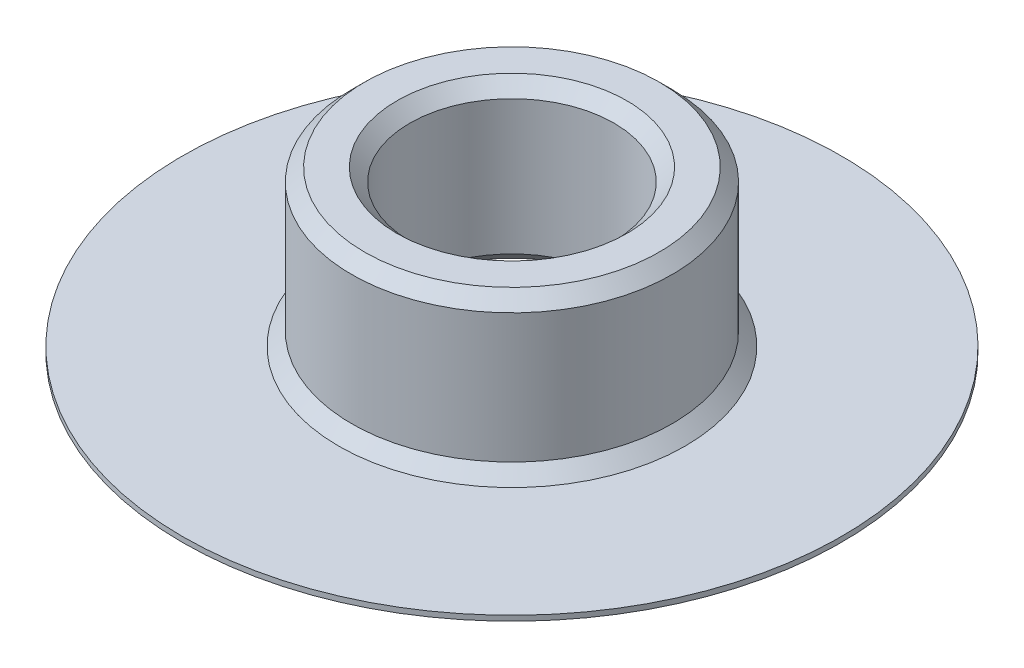
from build123d import *

# Parameters (mm, degrees)
SKETCH_1_R          = 12.75
EXTRUDE_1_DEPTH     = 0.2
SKETCH_2_R          = 6.2
EXTRUDE_2_DEPTH     = 6
SKETCH_3_R          = 3.95
CUT_EXTRUDE_1_DEPTH = 20.067380523
CHAMFER_1_SIZE      = 0.5


with BuildPart() as part:
    # Эскиз1 → Бобышка-Вытянуть1 (new body)
    with BuildSketch(Plane(origin=(0, 0, 0), x_dir=(1, 0, 0), z_dir=(0, 1, 0))):
        with Locations(Location((0, 0, 0), (0, 0, 270))):
            Circle(SKETCH_1_R)
    extrude(amount=EXTRUDE_1_DEPTH)

    # Эскиз2 → Бобышка-Вытянуть2 (add)
    with BuildSketch(Plane(origin=(0, 0.2, 0), x_dir=(1, 0, 0), z_dir=(0, 1, 0))):
        with Locations(Location((0, 0, 0), (0, 0, 90))):
            Circle(SKETCH_2_R)
    extrude(amount=EXTRUDE_2_DEPTH)

    # Эскиз3 → Вырез-Вытянуть1 (cut, through all)
    with BuildSketch(Plane(origin=(0, 6.2, 0), x_dir=(1, 0, 0), z_dir=(0, 1, 0))):
        with Locations(Location((0, 0, 0), (0, 0, 270))):
            Circle(SKETCH_3_R)
    extrude(amount=-CUT_EXTRUDE_1_DEPTH, mode=Mode.SUBTRACT)

    # Фаска1
    chamfer_1_edges = [part.edges().sort_by_distance(p)[0] for p in [
        (0, 0, -3.95),
        (0, 6.2, -3.95),
        (0, 0.2, 6.2),
        (0, 6.2, 6.2),
    ]]
    chamfer(chamfer_1_edges, length=CHAMFER_1_SIZE)


solid = part.part
